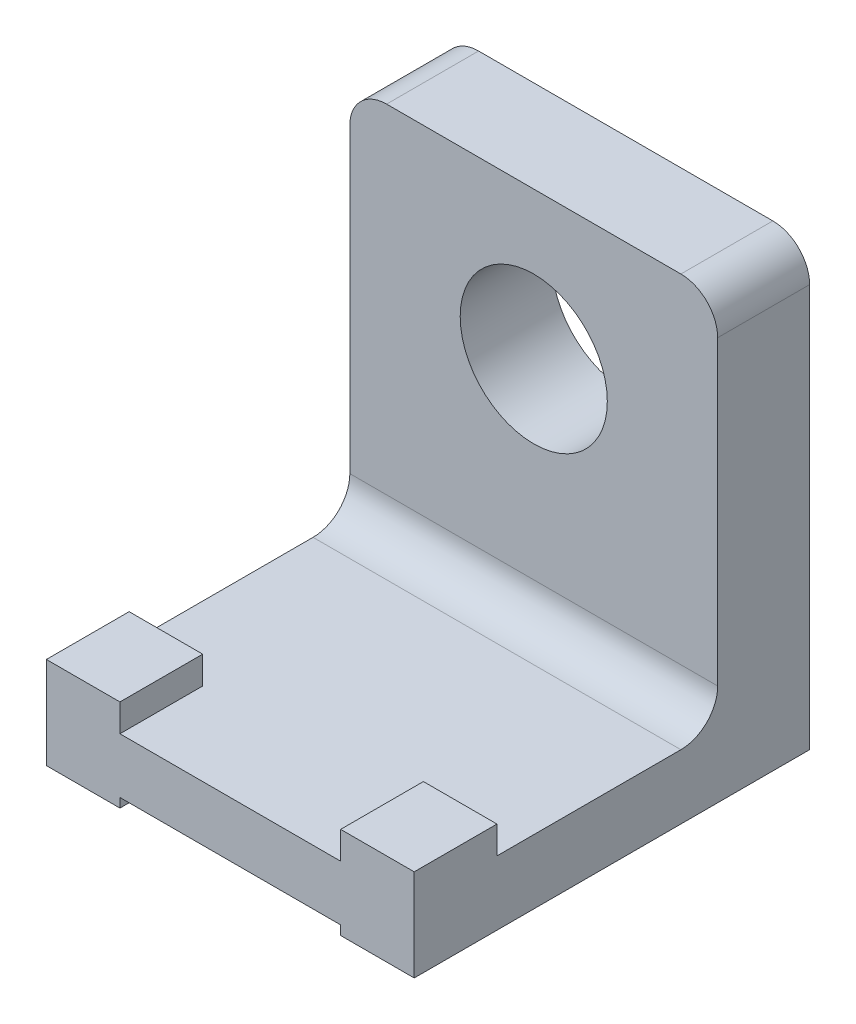
from build123d import *

# Parameters (mm, degrees)
EXTRUDE_2_DEPTH     = 127
EXTRUDE_3_DEPTH     = 28.575
EXTRUDE_6_DEPTH     = 31.75
SKETCH_5_R          = 25.4
CUT_EXTRUDE_4_DEPTH = 31.75
SKETCH_6_W          = 76.2
SKETCH_6_H          = 3.175
CUT_EXTRUDE_5_DEPTH = 136.525


with BuildPart() as part:
    # 草图1 → 凸台-拉伸2 (new body)
    with BuildSketch(Plane(origin=(0, 0, 0), x_dir=(0, 0, -1), z_dir=(1, 0, 0))):
        with BuildLine():
            Line((0, 0), (107.95, 0))
            Line((107.95, 0), (107.95, 75.565))
            Line((107.95, 75.565), (76.2, 75.565))
            Line((76.2, 75.565), (76.2, 34.925))
            ThreePointArc((76.2, 34.925), (72.480256121, 25.944743879), (63.5, 22.225))
            Line((63.5, 22.225), (0, 22.225))
            Line((0, 22.225), (0, 0))
        make_face()
    extrude(amount=-EXTRUDE_2_DEPTH)

    # 草图2 → 凸台-拉伸3 (add)
    with BuildSketch(Plane.XY):
        Polygon((0, 0), (0, 31.75), (-25.4, 31.75), (-25.4, 22.225), (-101.6, 22.225), (-101.6, 31.75), (-127, 31.75), (-127, 0), align=None)
    extrude(amount=EXTRUDE_3_DEPTH)

    # 草图3 → 凸台-拉伸6 (add)
    with BuildSketch(Plane(origin=(0, 0, -107.95), x_dir=(-1, 0, 0), z_dir=(0, 0, -1))):
        with BuildLine():
            Line((0, 75.565), (0, 139.065))
            ThreePointArc((0, 139.065), (3.719743879, 148.045256121), (12.7, 151.765))
            Line((12.7, 151.765), (114.3, 151.765))
            ThreePointArc((114.3, 151.765), (123.280256121, 148.045256121), (127, 139.065))
            Line((127, 139.065), (127, 75.565))
            Line((127, 75.565), (0, 75.565))
        make_face()
    extrude(amount=-EXTRUDE_6_DEPTH)

    # 草图5 → 切除-拉伸4 (cut)
    with BuildSketch(Plane(origin=(0, 0, -107.95), x_dir=(-1, 0, 0), z_dir=(0, 0, -1))):
        with Locations((63.5, 100.965)):
            Circle(SKETCH_5_R)
    extrude(amount=-CUT_EXTRUDE_4_DEPTH, mode=Mode.SUBTRACT)

    # 草图6 → 切除-拉伸5 (cut)
    with BuildSketch(Plane.XY.offset(28.575)):
        with Locations((-63.5, 1.5875)):
            Rectangle(SKETCH_6_W, SKETCH_6_H)
    extrude(amount=-CUT_EXTRUDE_5_DEPTH, mode=Mode.SUBTRACT)


solid = part.part
